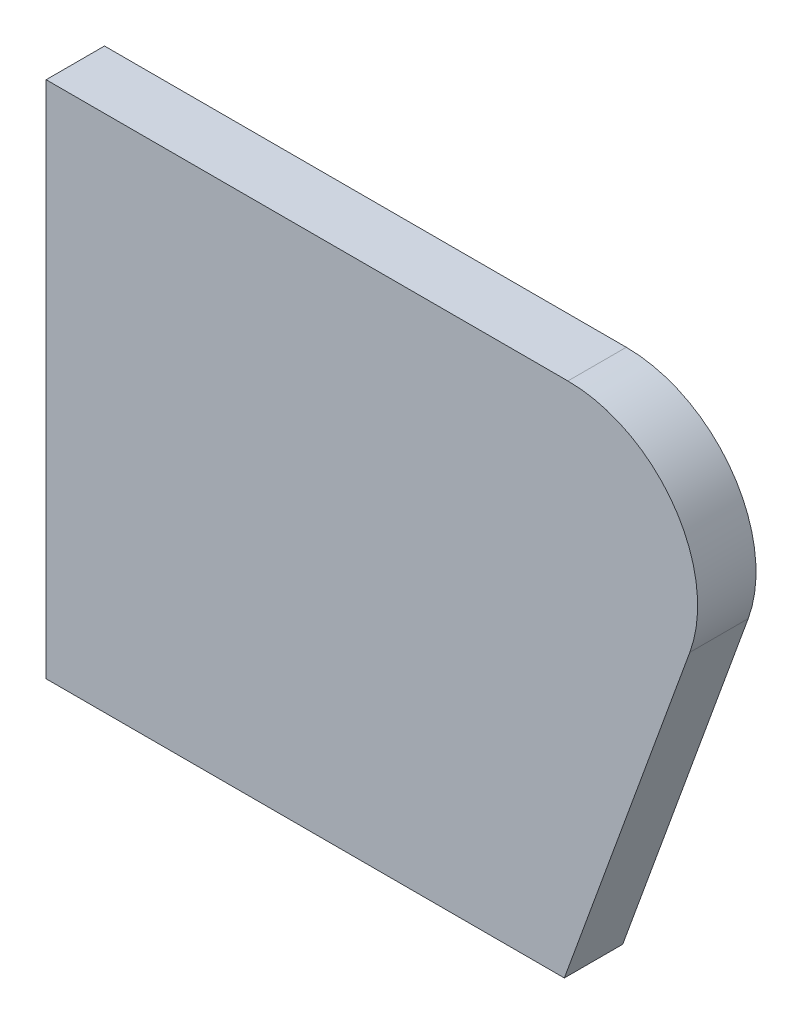
from build123d import *

# Parameters (mm, degrees)
BOSS_EXTRUDE1_DEPTH = 180


with BuildPart() as part:
    # Sketch1 → Boss-Extrude1 (new body)
    with BuildSketch(Plane.XY):
        with BuildLine():
            Line((-585.929666667, 1301.239516426), (-585.929666667, -298.754652174))
            Line((-585.929666667, -298.754652174), (1012.060333333, -298.754652174))
            Line((1012.060333333, -298.754652174), (1399.028402557, 764.431380069))
            ThreePointArc((1399.028402557, 764.431380069), (1350.809763496, 1130.673571787), (1023.142800443, 1301.239516426))
            Line((1023.142800443, 1301.239516426), (-585.929666667, 1301.239516426))
        make_face()
    extrude(amount=BOSS_EXTRUDE1_DEPTH)


solid = part.part
